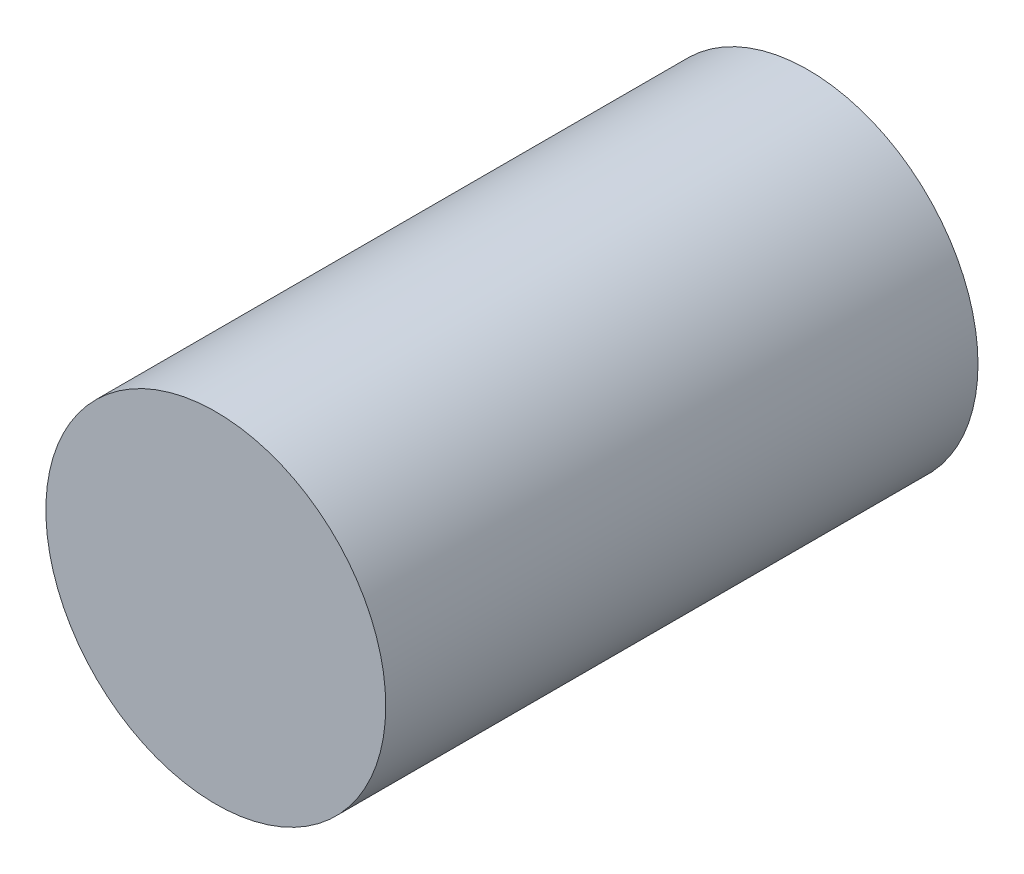
from build123d import *

# Parameters (mm, degrees)
SCHIZZO1_R                   = 33
ESTRUSIONE_ESTRUSIONE1_DEPTH = 115


with BuildPart() as part:
    # Schizzo1 → Estrusione-Estrusione1 (new body)
    with BuildSketch(Plane.XY):
        Circle(SCHIZZO1_R)
    extrude(amount=ESTRUSIONE_ESTRUSIONE1_DEPTH)


solid = part.part
